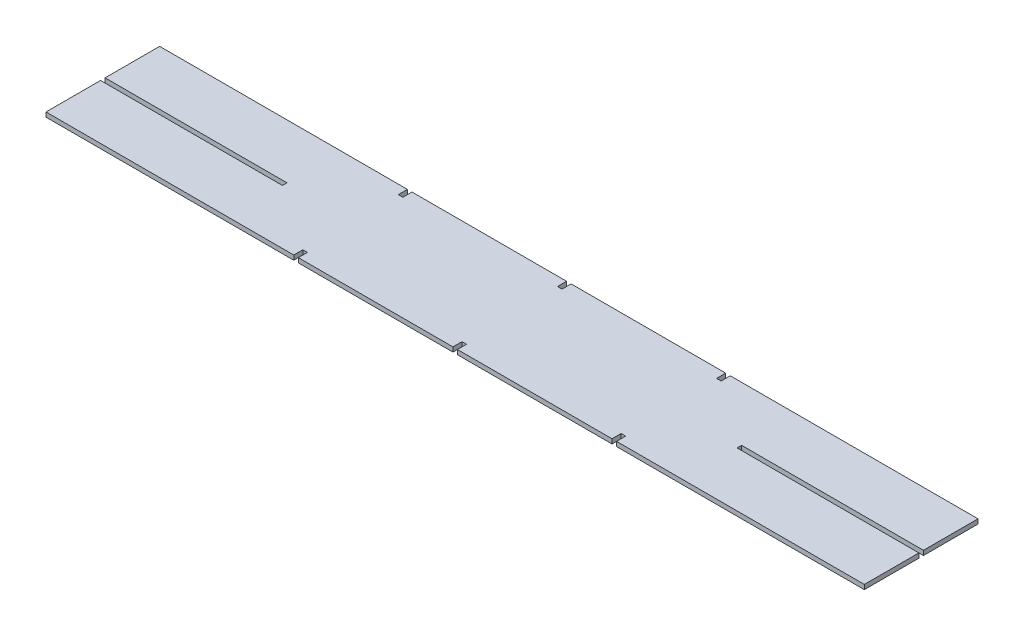
from build123d import *

# Parameters (mm, degrees)
BOSS_EXTRUDE1_DEPTH = 1


with BuildPart() as part:
    # Sketch1 → Boss-Extrude1 (new body)
    with BuildSketch(Plane(origin=(0, 0, 0), x_dir=(1, 0, 0), z_dir=(0, 1, 0))):
        Polygon((-0.5, 12.5), (-0.5, 10.5), (0.5, 10.5), (0.5, 12.5), (34.5, 12.5), (34.5, 10.5), (35.5, 10.5), (35.5, 12.5), (90, 12.5), (90, 0.5), (50, 0.5), (50, -0.5), (90, -0.5), (90, -12.5), (35.5, -12.5), (35.5, -10.5), (34.5, -10.5), (34.5, -12.5), (0.5, -12.5), (0.5, -10.5), (-0.5, -10.5), (-0.5, -12.5), (-34.5, -12.5), (-34.5, -10.5), (-35.5, -10.5), (-35.5, -12.5), (-90, -12.5), (-90, -0.5), (-50, -0.5), (-50, 0.5), (-90, 0.5), (-90, 12.5), (-35.5, 12.5), (-35.5, 10.5), (-34.5, 10.5), (-34.5, 12.5), align=None)
    extrude(amount=BOSS_EXTRUDE1_DEPTH)


solid = part.part
